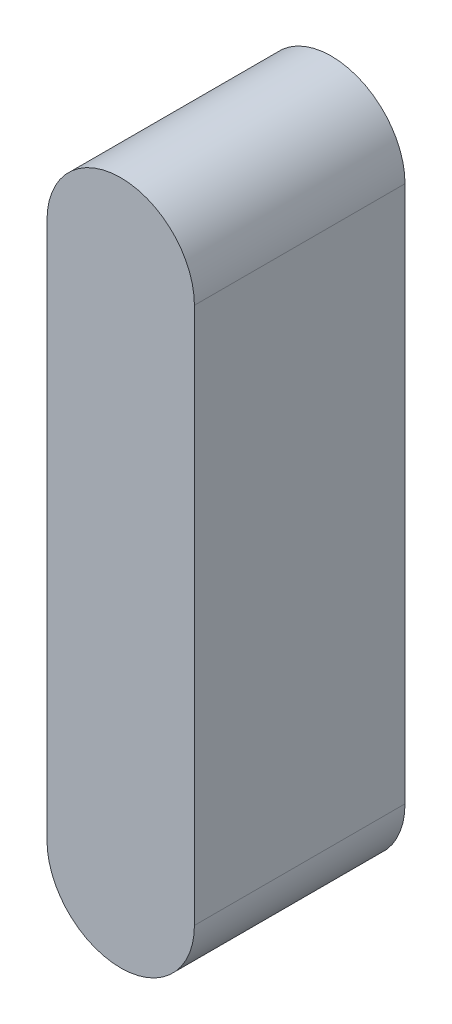
from build123d import *

# Parameters (mm, degrees)
BOSS_EXTRUDE1_DEPTH = 4


with BuildPart() as part:
    # Sketch1 → Boss-Extrude1 (new body)
    with BuildSketch(Plane.XY):
        with BuildLine():
            Line((0, 6.5), (0, -6.5))
            ThreePointArc((0, -6.5), (0.989949494, -6.089949494), (1.4, -5.1))
            Line((1.4, -5.1), (1.4, 5.1))
            ThreePointArc((1.4, 5.1), (0.989949494, 6.089949494), (0, 6.5))
        make_face()
        with BuildLine():
            Line((-1.4, 5.1), (-1.4, -5.1))
            ThreePointArc((-1.4, -5.1), (-0.989949494, -6.089949494), (0, -6.5))
            Line((0, -6.5), (0, 6.5))
            ThreePointArc((0, 6.5), (-0.989949494, 6.089949494), (-1.4, 5.1))
        make_face()
    extrude(amount=BOSS_EXTRUDE1_DEPTH)


solid = part.part
